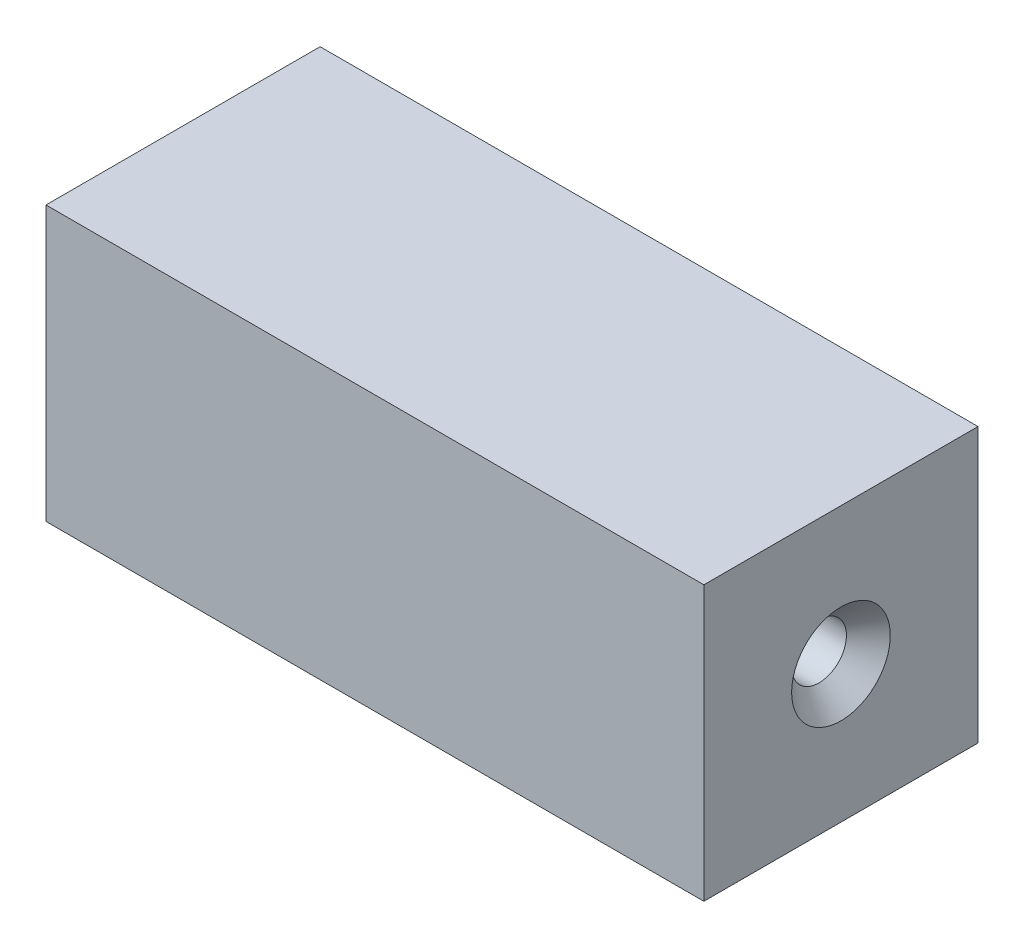
from build123d import *

# Parameters (mm, degrees)
SKETCH1_W           = 31.75
SKETCH1_H           = 31.75
BOSS_EXTRUDE1_DEPTH = 76.2
SKETCH2_R           = 3.175
CUT_EXTRUDE1_DEPTH  = 25.4
CHAMFER1_SIZE       = 2.54


with BuildPart() as part:
    # Sketch1 → Boss-Extrude1 (new body)
    with BuildSketch(Plane(origin=(0, 0, 0), x_dir=(0, 0, -1), z_dir=(1, 0, 0))):
        Rectangle(SKETCH1_W, SKETCH1_H)
    extrude(amount=BOSS_EXTRUDE1_DEPTH)

    # Sketch2 → Cut-Extrude1 (cut)
    with BuildSketch(Plane(origin=(76.2, 0, 0), x_dir=(0, 0, -1), z_dir=(1, 0, 0))):
        Circle(SKETCH2_R)
    extrude(amount=-CUT_EXTRUDE1_DEPTH, mode=Mode.SUBTRACT)

    # Chamfer1
    chamfer1_edges = [part.edges().sort_by_distance(p)[0] for p in [
        (76.2, 0, 3.175),
    ]]
    chamfer(chamfer1_edges, length=CHAMFER1_SIZE)


solid = part.part
